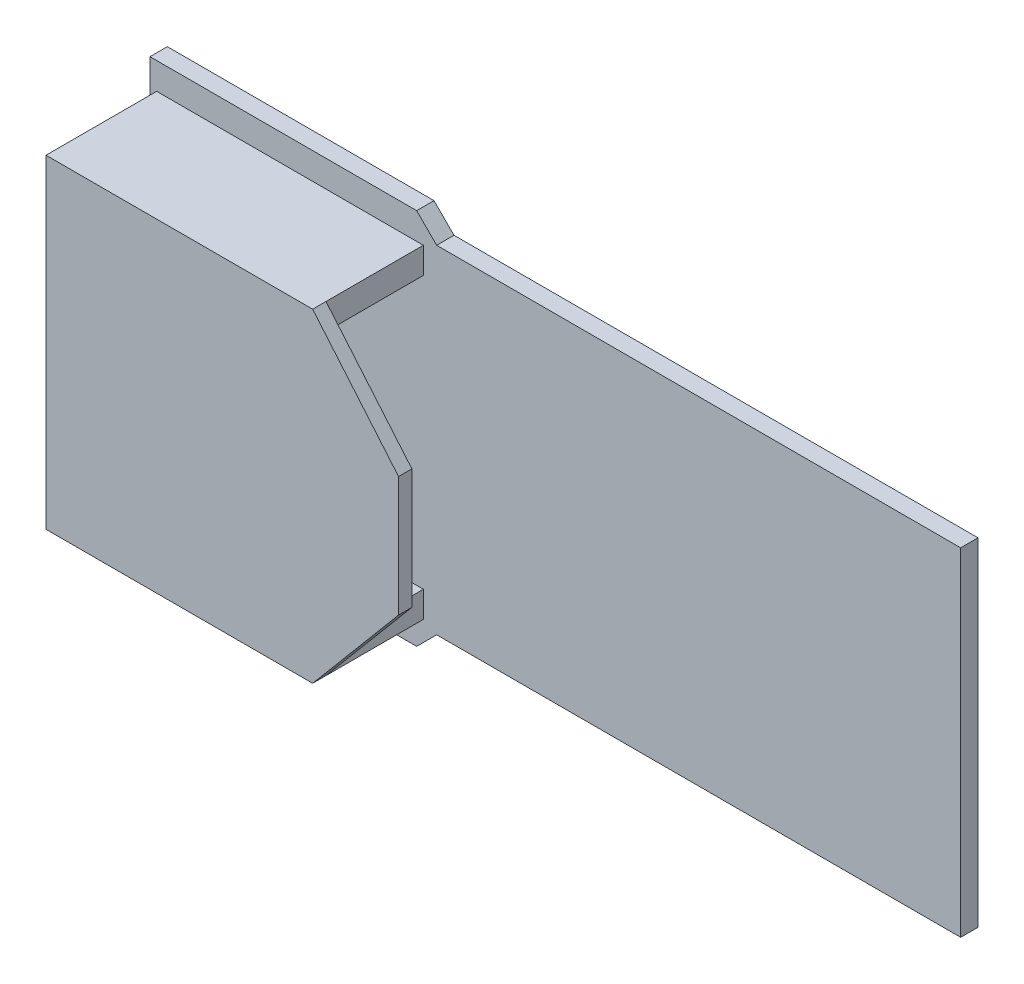
from build123d import *

# Parameters (mm, degrees)
BOSS_EXTRU_1_DEPTH      = 1.3
ESQUISSE2_W             = 8
ESQUISSE2_H             = 7
BOSS_EXTRU_3_DEPTH      = 4
ESQUISSE5_W             = 5
ESQUISSE5_H             = 8
BOSS_EXTRU_4_DEPTH      = 6
ESQUISSE6_W             = 3
ESQUISSE6_H             = 6
ENL_V_MAT_EXTRU_1_DEPTH = 7
ESQUISSE7_W             = 5
ESQUISSE7_H             = 7
ENL_V_MAT_EXTRU_2_DEPTH = 4
ESQUISSE8_W             = 20
ESQUISSE8_H             = 1.959214555
BOSS_EXTRU_5_DEPTH      = 7.3
BOSS_EXTRU_6_DEPTH      = 1


with BuildPart() as part:
    # Esquisse1 → Boss.-Extru.1 (new body)
    with BuildSketch(Plane.XY):
        Polygon((0, -14.15), (0, 14.15), (20, 14.15), (21.5, 12.65), (60.8, 12.65), (60.8, -12.65), (21.5, -12.65), (20, -14.15), align=None)
    extrude(amount=BOSS_EXTRU_1_DEPTH)

    # Esquisse2 → Boss.-Extru.3 (add)
    with BuildSketch(Plane(origin=(0, 0, 0), x_dir=(-1, 0, 0), z_dir=(0, 0, -1))):
        with Locations((-4, 4.65)):
            Rectangle(ESQUISSE2_W, ESQUISSE2_H)
    extrude(amount=BOSS_EXTRU_3_DEPTH)

    # Esquisse5 → Boss.-Extru.4 (add)
    with BuildSketch(Plane(origin=(0, 0, 0), x_dir=(-1, 0, 0), z_dir=(0, 0, -1))):
        with Locations((-2.5, -6.15)):
            Rectangle(ESQUISSE5_W, ESQUISSE5_H)
    extrude(amount=BOSS_EXTRU_4_DEPTH)

    # Esquisse6 → Enlèv. mat.-Extru.1 (cut)
    with BuildSketch(Plane.ZY):
        with Locations((-2, 4.65)):
            Rectangle(ESQUISSE6_W, ESQUISSE6_H)
    extrude(amount=-ENL_V_MAT_EXTRU_1_DEPTH, mode=Mode.SUBTRACT)

    # Esquisse7 → Enlèv. mat.-Extru.2 (cut)
    with BuildSketch(Plane.ZY):
        with Locations((-3, -6.15)):
            Rectangle(ESQUISSE7_W, ESQUISSE7_H)
    extrude(amount=-ENL_V_MAT_EXTRU_2_DEPTH, mode=Mode.SUBTRACT)

    # Esquisse8 → Boss.-Extru.5 (add)
    with BuildSketch(Plane.XY.offset(1.3)):
        with Locations((10.5, 11.170392723)):
            Rectangle(ESQUISSE8_W, ESQUISSE8_H)
        with Locations((10.5, -11.170392723)):
            Rectangle(ESQUISSE8_W, ESQUISSE8_H)
    extrude(amount=BOSS_EXTRU_5_DEPTH)

    # Esquisse10 → Boss.-Extru.6 (add)
    with BuildSketch(Plane.XY.offset(8.6)):
        Polygon((0.5, 12.15), (0.5, -12.15), (20.5, -12.15), (26.940302788, -4.5), (26.940302788, 4.5), (20.5, 12.15), align=None)
    extrude(amount=BOSS_EXTRU_6_DEPTH)


solid = part.part
